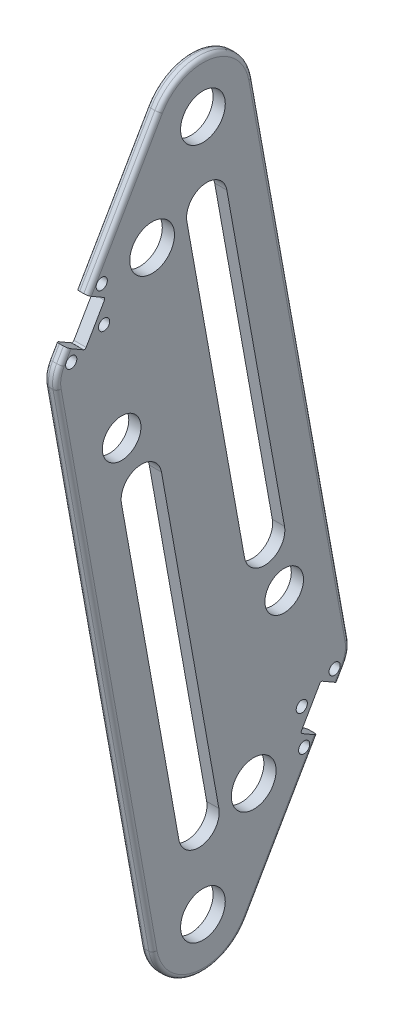
from build123d import *

# Parameters (mm, degrees)
SKETCH_2_R          = 9.5
SKETCH_2_R_2        = 11
EXTRUDE_1_DEPTH     = 6
CUT_EXTRUDE_1_DEPTH = 10
FILLET_1_R          = 25
SKETCH_4_R          = 2.75
CUT_EXTRUDE_2_DEPTH = 10
FILLET_2_R          = 15
FILLET_3_R          = 1
FILLET_4_R          = 2


with BuildPart() as part:
    # 草图2 → 凸台-拉伸1 (new body)
    with BuildSketch(Plane(origin=(0, 0, 0), x_dir=(0, 0, -1), z_dir=(1, 0, 0))):
        Polygon((12.494318662, 71.640794729), (-72.751567756, -76.009411684), (-12.535755442, -411.712565336), (72.916857811, -263.704297543), align=None)
        with Locations((-40, -117)):
            Circle(SKETCH_2_R, mode=Mode.SUBTRACT)
        with Locations((25, -296.698729811)):
            Circle(SKETCH_2_R_2, mode=Mode.SUBTRACT)
        with Locations((0, -340)):
            Circle(SKETCH_2_R_2, mode=Mode.SUBTRACT)
        with Locations((-25, -43.301270189)):
            Circle(SKETCH_2_R_2, mode=Mode.SUBTRACT)
        with Locations((40, -222)):
            Circle(SKETCH_2_R, mode=Mode.SUBTRACT)
        Circle(SKETCH_2_R_2, mode=Mode.SUBTRACT)
    extrude(amount=EXTRUDE_1_DEPTH)

    # 草图3 → 切除-拉伸1 (cut)
    with BuildSketch(Plane(origin=(6, 0, 0), x_dir=(0, 0, -1), z_dir=(1, 0, 0))):
        with BuildLine():
            Line((-20.40575236, -141.278289439), (7.842954525, -298.764830322))
            ThreePointArc((7.842954525, -298.764830322), (-0.2344101, -310.373283308), (-11.842863085, -302.295918683))
            Line((-11.842863085, -302.295918683), (-40.09156997, -144.8093778))
            ThreePointArc((-40.09156997, -144.8093778), (-32.014205345, -133.200924814), (-20.40575236, -141.278289439))
        make_face()
        with BuildLine():
            Line((11.783440235, -37.201240644), (40.155401092, -194.665623401))
            ThreePointArc((40.155401092, -194.665623401), (32.087124724, -206.280394877), (20.472353248, -198.212118508))
            Line((20.472353248, -198.212118508), (-7.89960761, -40.747735751))
            ThreePointArc((-7.89960761, -40.747735751), (0.168668759, -29.132964275), (11.783440235, -37.201240644))
        make_face()
    extrude(amount=-CUT_EXTRUDE_1_DEPTH, mode=Mode.SUBTRACT)

    # 圆角1
    fillet_1_edges = [part.edges().sort_by_distance(p)[0] for p in [
        (3, -411.712565336, 12.535755442),
        (3, 71.640794729, -12.494318662),
    ]]
    fillet(fillet_1_edges, radius=FILLET_1_R)

    # 草图4 → 切除-拉伸2 (cut)
    with BuildSketch(Plane(origin=(6, 0, 0), x_dir=(0, 0, -1), z_dir=(1, 0, 0))):
        with Locations((-49.820508076, -46.291651246)):
            Circle(SKETCH_4_R)
        with Locations((-64.820508076, -72.27241336)):
            Circle(SKETCH_4_R)
        with Locations((-48.660254038, -64.282032303)):
            Circle(SKETCH_4_R)
        with Locations((48.660254038, -275.717967697)):
            Circle(SKETCH_4_R)
        with Locations((49.820508076, -293.708348754)):
            Circle(SKETCH_4_R)
        with Locations((64.820508076, -267.72758664)):
            Circle(SKETCH_4_R)
        Polygon((-66.650635095, -65.442286341), (-56.650635095, -48.121778265), (-47.990381057, -53.121778265), (-57.990381057, -70.442286341), align=None)
        Polygon((47.990381057, -286.878221735), (57.990381057, -269.557713659), (66.650635095, -274.557713659), (56.650635095, -291.878221735), align=None)
    extrude(amount=-CUT_EXTRUDE_2_DEPTH, mode=Mode.SUBTRACT)

    # 圆角2
    fillet_2_edges = [part.edges().sort_by_distance(p)[0] for p in [
        (3, -263.704297543, -72.916857811),
        (3, -76.009411684, 72.751567756),
    ]]
    fillet(fillet_2_edges, radius=FILLET_2_R)

    # 圆角3
    fillet_3_edges = [part.edges().sort_by_distance(p)[0] for p in [
        (3, -286.878221735, -47.990381057),
        (3, -269.557713659, -57.990381057),
        (3, -53.121778265, 47.990381057),
        (3, -70.442286341, 57.990381057),
    ]]
    fillet(fillet_3_edges, radius=FILLET_3_R)

    # 圆角4
    fillet_4_edges = [part.edges().sort_by_distance(p)[0] for p in [
        (0, -212.910875987, 48.195251289),
        (6, -212.910875987, 48.195251289),
        (0, -126.933453974, -48.273462573),
        (0, -263.537032824, -71.957783708),
        (0, -76.176657925, 71.794811932),
        (6, -126.933453974, -48.273462573),
        (6, -263.537032824, -71.957783708),
        (6, -76.176657925, 71.794811932),
        (0, -322.189110868, -39.150635095),
        (6, -322.189110868, -39.150635095),
        (0, -17.810889132, 39.150635095),
        (0, 24.628257085, -4.295224436),
        (0, -364.626574291, 4.304862213),
        (6, -17.810889132, 39.150635095),
        (6, 24.628257085, -4.295224436),
        (6, -364.626574291, 4.304862213),
        (6, -271.508805911, -68.410922804),
        (0, -271.508805911, -68.410922804),
        (6, -68.350930797, 68.329941754),
        (0, -68.350930797, 68.329941754),
    ]]
    fillet(fillet_4_edges, radius=FILLET_4_R)


solid = part.part
